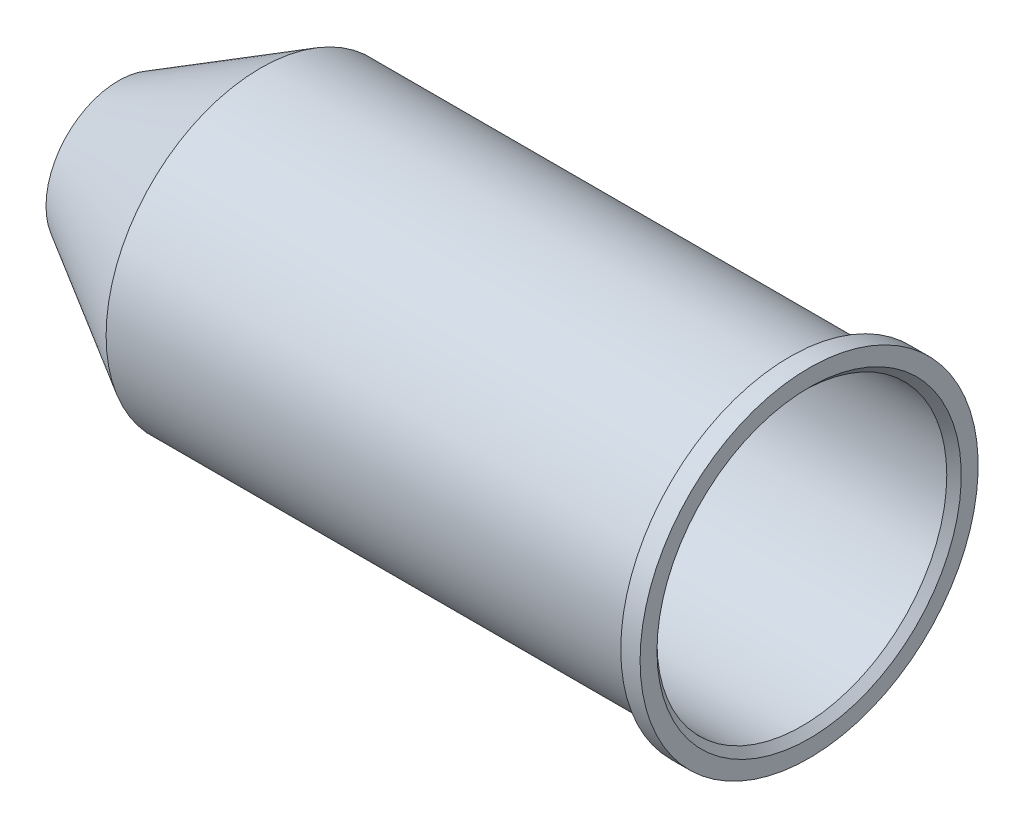
from build123d import *


with BuildPart() as part:
    # Эскиз1 → Повернуть1 (revolve)
    with BuildSketch(Plane.XY, mode=Mode.PRIVATE) as revolve_1_sk:
        with BuildLine():
            Line((0, 15), (29.444863729, 32))
            Line((29.444863729, 32), (139, 32))
            Line((139, 32), (139, 35))
            Line((139, 35), (143, 35))
            Line((143, 35), (143, 31.5))
            Line((143, 31.5), (141.5, 30))
            Line((141.5, 30), (41.5, 30))
            Line((41.5, 30), (19.394228634, 7.894228634))
            ThreePointArc((19.394228634, 7.894228634), (18.573684899, 7.398584574), (17.616752191, 7.341708844))
            Line((17.616752191, 7.341708844), (16.948603844, 7.4651183))
            ThreePointArc((16.948603844, 7.4651183), (16.871071065, 7.481031521), (16.794228634, 7.5))
            Line((16.794228634, 7.5), (0, 12))
            Line((0, 12), (0, 15))
        make_face()
    revolve(revolve_1_sk.sketch.rotate(Axis((0, 0, 0), (1, 0, 0)), 90), axis=Axis((0, 0, 0), (1, 0, 0)))


solid = part.part
